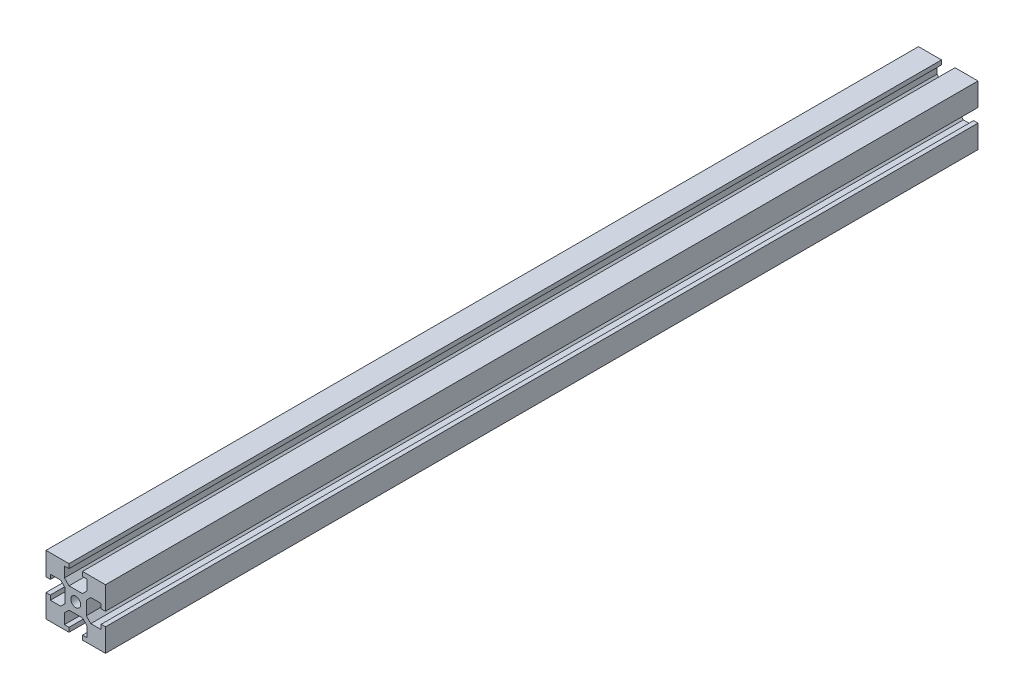
from build123d import *

# Parameters (mm, degrees)
SKETCH_2_R      = 1.25
EXTRUDE_1_DEPTH = 220


with BuildPart() as part:
    # ｽｹｯﾁ2 → ﾎﾞｽ - 押し出し1 (new body)
    with BuildSketch(Plane.XY):
        Polygon((1.7, 2.65), (-1.7, 2.65), (-2.85, 3.8), (-2.85, 6.4), (-1.7, 6.4), (-1.7, 7.5), (-7.5, 7.5), (-7.5, 1.7), (-6.4, 1.7), (-6.4, 2.85), (-3.8, 2.85), (-2.65, 1.7), (-2.65, -1.7), (-3.8, -2.85), (-6.4, -2.85), (-6.4, -1.7), (-7.5, -1.7), (-7.5, -7.5), (-1.7, -7.5), (-1.7, -6.4), (-2.85, -6.4), (-2.85, -3.8), (-1.7, -2.65), (1.7, -2.65), (2.85, -3.8), (2.85, -6.4), (1.7, -6.4), (1.7, -7.5), (7.5, -7.5), (7.5, -1.7), (6.4, -1.7), (6.4, -2.85), (3.8, -2.85), (2.65, -1.7), (2.65, 1.7), (3.8, 2.85), (6.4, 2.85), (6.4, 1.7), (7.5, 1.7), (7.5, 7.5), (1.7, 7.5), (1.7, 6.4), (2.85, 6.4), (2.85, 3.8), align=None)
        Circle(SKETCH_2_R, mode=Mode.SUBTRACT)
    extrude(amount=EXTRUDE_1_DEPTH)


solid = part.part
